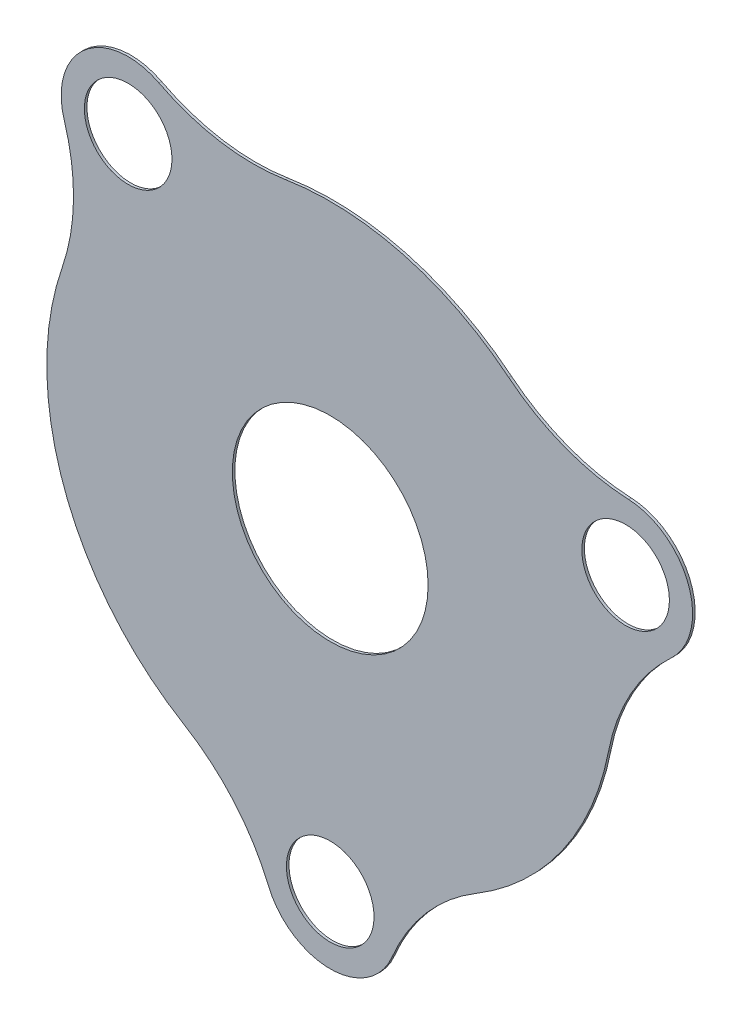
from build123d import *

# Parameters (mm, degrees)
SKETCH1_R      = 8.5
SKETCH1_R_2    = 19
EXTRUDE1_DEPTH = 0.5


with BuildPart() as part:
    # Sketch1 → Extrude1 (new body)
    with BuildSketch(Plane.XY):
        with BuildLine():
            ThreePointArc((-11.993220936, -66.016238788), (0, -74), (11.993220936, -66.016238788))
            ThreePointArc((11.993220936, -66.016238788), (18.643198205, -55.282099515), (28.307885854, -47.155737705))
            ThreePointArc((28.307885854, -47.155737705), (45.053362436, -31.546703999), (53.993765926, -10.472499278))
            ThreePointArc((53.993765926, -10.472499278), (58.324530298, 1.388715818), (66.136895584, 11.308942239))
            ThreePointArc((66.136895584, 11.308942239), (69.537253938, 25.309490606), (57.933049297, 33.848824665))
            ThreePointArc((57.933049297, 33.848824665), (45.571831653, 36.426467381), (34.630031572, 42.728923615))
            ThreePointArc((34.630031572, 42.728923615), (14.235047481, 53.125920446), (-8.626025268, 54.319349113))
            ThreePointArc((-8.626025268, 54.319349113), (-21.253130218, 54.332161948), (-33.247080077, 58.280466697))
            ThreePointArc((-33.247080077, 58.280466697), (-47.566283117, 56.687288791), (-51.621760584, 42.862279061))
            ThreePointArc((-51.621760584, 42.862279061), (-49.816166993, 30.364928326), (-51.996222577, 17.927432547))
            ThreePointArc((-51.996222577, 17.927432547), (-51.683094143, -18.811107883), (-28.307885854, -47.155737705))
            ThreePointArc((-28.307885854, -47.155737705), (-18.643198205, -55.282099515), (-11.993220936, -66.016238788))
        make_face()
        with Locations((57.321249868, 20.863228743)):
            Circle(SKETCH1_R, mode=Mode.SUBTRACT)
        with Locations((-39.210044191, 46.72871103)):
            Circle(SKETCH1_R, mode=Mode.SUBTRACT)
        with Locations((0, -61)):
            Circle(SKETCH1_R, mode=Mode.SUBTRACT)
        Circle(SKETCH1_R_2, mode=Mode.SUBTRACT)
    extrude(amount=EXTRUDE1_DEPTH)


solid = part.part
